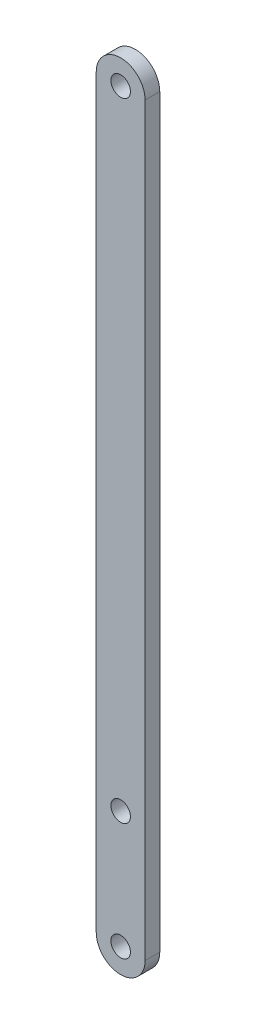
from build123d import *

# Parameters (mm, degrees)
SKETCH1_R           = 2
SKETCH1_R_2         = 5
BOSS_EXTRUDE1_DEPTH = 3


with BuildPart() as part:
    # Sketch1 → Boss-Extrude1 (new body)
    # profile 1 of 3: a face of its own
    with BuildSketch(Plane.XY):
        with BuildLine():
            Line((-5, 152.5), (-5, 0))
            ThreePointArc((-5, 0), (0, 5), (5, 0))
            Line((5, 0), (5, 152.5))
            ThreePointArc((5, 152.5), (0, 147.5), (-5, 152.5))
        make_face()
        with Locations((0, 24)):
            Circle(SKETCH1_R, mode=Mode.SUBTRACT)
    # profile 2 of 3: a face of its own
    with BuildSketch(Plane.XY):
        with Locations((0, 152.5)):
            Circle(SKETCH1_R_2)
        with Locations((0, 152.5)):
            Circle(SKETCH1_R, mode=Mode.SUBTRACT)
    # profile 3 of 3: a face of its own
    with BuildSketch(Plane.XY):
        Circle(SKETCH1_R_2)
        Circle(SKETCH1_R, mode=Mode.SUBTRACT)
    extrude(amount=BOSS_EXTRUDE1_DEPTH)


solid = part.part
